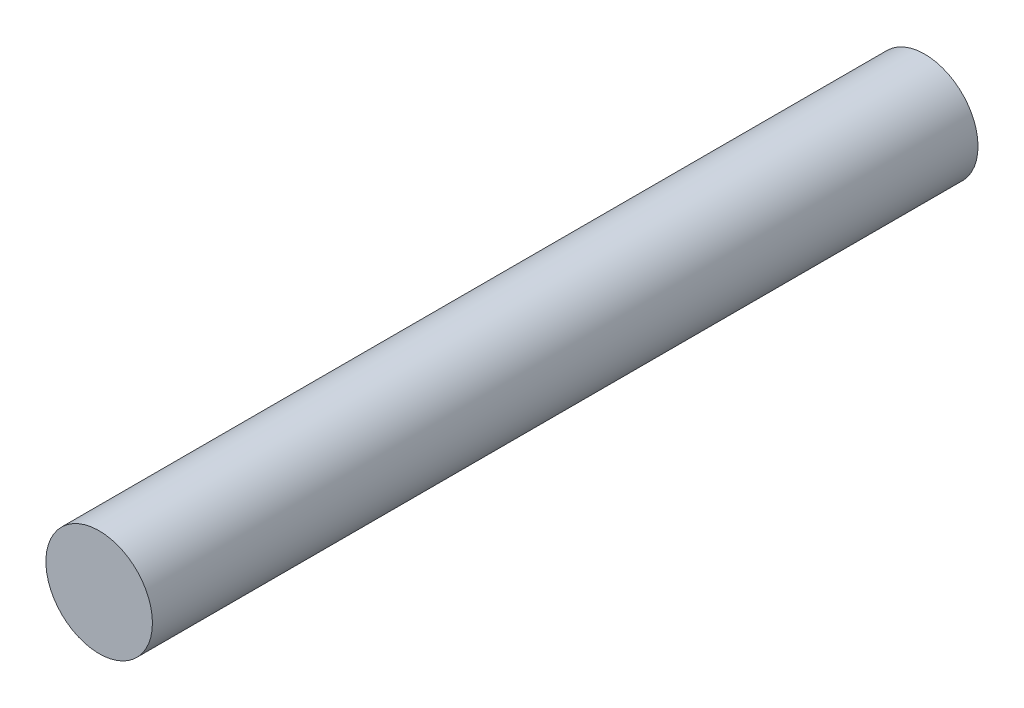
from build123d import *

# Parameters (mm, degrees)
SKETCH1_R           = 3.175
BOSS_EXTRUDE1_DEPTH = 49.2125


with BuildPart() as part:
    # Sketch1 → Boss-Extrude1 (new body)
    with BuildSketch(Plane.XY):
        Circle(SKETCH1_R)
    extrude(amount=BOSS_EXTRUDE1_DEPTH)


solid = part.part
